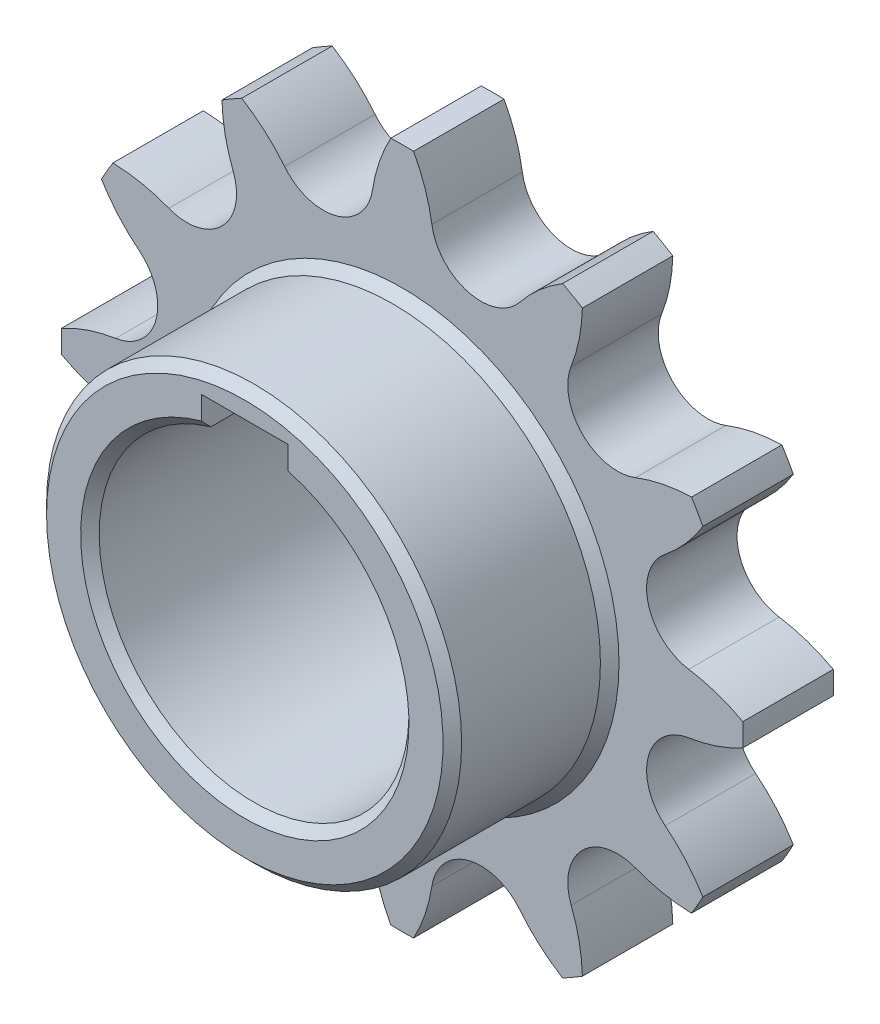
from build123d import *

# Parameters (mm, degrees)
SKETCH2_R           = 25
BOSS_EXTRUDE1_DEPTH = 14.6
SKETCH3_R           = 33.5
SKETCH3_R_2         = 25
BOSS_EXTRUDE2_DEPTH = 40
SKETCH6_W           = 14
SKETCH6_H           = 12
CUT_EXTRUDE1_DEPTH  = 64
CHAMFER1_SIZE       = 1.5


with BuildPart() as part:
    # Sketch2 → Boss-Extrude1 (new body)
    with BuildSketch(Plane.XY):
        with BuildLine():
            ThreePointArc((-18.974755856, 42.454209074), (-22.172929883, 45.798002784), (-25.900754962, 48.538913885))
            ThreePointArc((-25.900754962, 48.538913885), (-27.508522628, 47.646158833), (-29.085555016, 46.700168716))
            ThreePointArc((-29.085555016, 46.700168716), (-28.575768912, 42.101321947), (-27.279045628, 37.659725139))
            ThreePointArc((-27.279045628, 37.659725139), (-29.082617414, 29.082617413), (-37.659725139, 27.279045628))
            ThreePointArc((-37.659725139, 27.279045628), (-42.101321947, 28.575768912), (-46.700168717, 29.085555016))
            ThreePointArc((-46.700168717, 29.085555016), (-47.646158833, 27.508522628), (-48.538913885, 25.900754962))
            ThreePointArc((-48.538913885, 25.900754962), (-45.798002784, 22.172929883), (-42.454209074, 18.974755856))
            ThreePointArc((-42.454209074, 18.974755856), (-39.727594195, 10.644976782), (-46.253801484, 4.794483935))
            ThreePointArc((-46.253801484, 4.794483935), (-50.748698795, 3.696680837), (-54.986309977, 1.838745168))
            ThreePointArc((-54.986309977, 1.838745168), (-55.017045256, 0), (-54.986309977, -1.838745169))
            ThreePointArc((-54.986309977, -1.838745169), (-50.748698795, -3.696680837), (-46.253801484, -4.794483935))
            ThreePointArc((-46.253801484, -4.794483935), (-39.727594195, -10.644976782), (-42.454209074, -18.974755856))
            ThreePointArc((-42.454209074, -18.974755856), (-45.798002784, -22.172929883), (-48.538913885, -25.900754962))
            ThreePointArc((-48.538913885, -25.900754962), (-47.646158833, -27.508522628), (-46.700168717, -29.085555016))
            ThreePointArc((-46.700168717, -29.085555016), (-42.101321947, -28.575768912), (-37.659725139, -27.279045628))
            ThreePointArc((-37.659725139, -27.279045628), (-29.082617413, -29.082617414), (-27.279045628, -37.659725139))
            ThreePointArc((-27.279045628, -37.659725139), (-28.575768912, -42.101321947), (-29.085555016, -46.700168717))
            ThreePointArc((-29.085555016, -46.700168717), (-27.508522628, -47.646158833), (-25.900754962, -48.538913885))
            ThreePointArc((-25.900754962, -48.538913885), (-22.172929883, -45.798002784), (-18.974755856, -42.454209074))
            ThreePointArc((-18.974755856, -42.454209074), (-10.644976782, -39.727594195), (-4.794483935, -46.253801484))
            ThreePointArc((-4.794483935, -46.253801484), (-3.696680837, -50.748698795), (-1.838745168, -54.986309977))
            ThreePointArc((-1.838745168, -54.986309977), (0, -55.017045256), (1.838745168, -54.986309977))
            ThreePointArc((1.838745168, -54.986309977), (3.696680837, -50.748698795), (4.794483935, -46.253801484))
            ThreePointArc((4.794483935, -46.253801484), (10.644976782, -39.727594195), (18.974755856, -42.454209074))
            ThreePointArc((18.974755856, -42.454209074), (22.172929883, -45.798002784), (25.900754962, -48.538913885))
            ThreePointArc((25.900754962, -48.538913885), (27.508522628, -47.646158833), (29.085555016, -46.700168716))
            ThreePointArc((29.085555016, -46.700168716), (28.575768912, -42.101321947), (27.279045628, -37.659725139))
            ThreePointArc((27.279045628, -37.659725139), (29.082617413, -29.082617414), (37.659725139, -27.279045628))
            ThreePointArc((37.659725139, -27.279045628), (42.101321947, -28.575768912), (46.700168716, -29.085555016))
            ThreePointArc((46.700168716, -29.085555016), (47.646158833, -27.508522628), (48.538913885, -25.900754962))
            ThreePointArc((48.538913885, -25.900754962), (45.798002784, -22.172929883), (42.454209074, -18.974755856))
            ThreePointArc((42.454209074, -18.974755856), (39.727594195, -10.644976782), (46.253801483, -4.794483935))
            ThreePointArc((46.253801483, -4.794483935), (50.748698795, -3.696680837), (54.986309977, -1.838745168))
            ThreePointArc((54.986309977, -1.838745168), (55.017045256, 0), (54.986309977, 1.838745169))
            ThreePointArc((54.986309977, 1.838745169), (50.748698795, 3.696680837), (46.253801484, 4.794483935))
            ThreePointArc((46.253801484, 4.794483935), (39.727594195, 10.644976782), (42.454209074, 18.974755856))
            ThreePointArc((42.454209074, 18.974755856), (45.798002784, 22.172929883), (48.538913885, 25.900754962))
            ThreePointArc((48.538913885, 25.900754962), (47.646158833, 27.508522628), (46.700168717, 29.085555015))
            ThreePointArc((46.700168717, 29.085555015), (42.101321947, 28.575768912), (37.659725139, 27.279045628))
            ThreePointArc((37.659725139, 27.279045628), (29.082617413, 29.082617413), (27.279045628, 37.659725139))
            ThreePointArc((27.279045628, 37.659725139), (28.575768912, 42.101321947), (29.085555016, 46.700168717))
            ThreePointArc((29.085555016, 46.700168717), (27.508522628, 47.646158833), (25.900754962, 48.538913885))
            ThreePointArc((25.900754962, 48.538913885), (22.172929883, 45.798002784), (18.974755856, 42.454209074))
            ThreePointArc((18.974755856, 42.454209074), (10.644976782, 39.727594195), (4.794483935, 46.253801483))
            ThreePointArc((4.794483935, 46.253801483), (3.696680837, 50.748698795), (1.838745168, 54.986309977))
            ThreePointArc((1.838745168, 54.986309977), (0, 55.017045256), (-1.838745168, 54.986309977))
            ThreePointArc((-1.838745168, 54.986309977), (-3.696680837, 50.748698795), (-4.794483935, 46.253801483))
            ThreePointArc((-4.794483935, 46.253801483), (-10.644976782, 39.727594195), (-18.974755856, 42.454209074))
        make_face()
        Circle(SKETCH2_R, mode=Mode.SUBTRACT)
    extrude(amount=BOSS_EXTRUDE1_DEPTH)

    # Sketch3 → Boss-Extrude2 (add)
    with BuildSketch(Plane(origin=(0, 0, 0), x_dir=(-1, 0, 0), z_dir=(0, 0, -1))):
        Circle(SKETCH3_R)
        Circle(SKETCH3_R_2, mode=Mode.SUBTRACT)
    extrude(amount=-BOSS_EXTRUDE2_DEPTH)

    # Sketch6 → Cut-Extrude1 (cut)
    with BuildSketch(Plane.XY.offset(40)):
        with Locations((0, 23.3)):
            Rectangle(SKETCH6_W, SKETCH6_H)
    extrude(amount=-CUT_EXTRUDE1_DEPTH, mode=Mode.SUBTRACT)

    # Chamfer1
    chamfer1_edges = [part.edges().sort_by_distance(p)[0] for p in [
        (33.5, 0, 14.6),
        (33.5, 0, 40),
        (15, -20, 40),
    ]]
    chamfer(chamfer1_edges, length=CHAMFER1_SIZE)


solid = part.part
